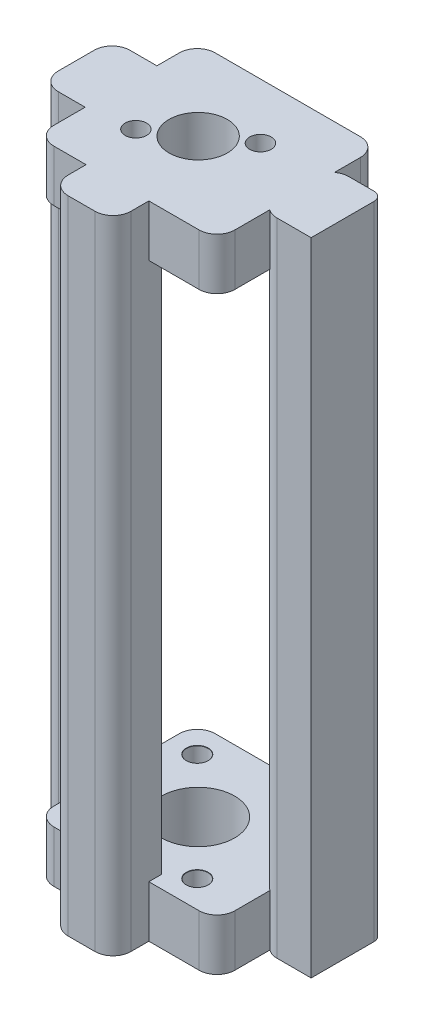
from build123d import *

# Parameters (mm, degrees)
SKETCH1_W                      = 20.2
SKETCH1_H                      = 18
BOSS_EXTRUDE1_DEPTH            = 5.75
M2_CLEARANCE_HOLE1_D           = 2.4
M2_CLEARANCE_HOLE1_CSINK_D     = 2.45
M2_CLEARANCE_HOLE1_CSINK_ANGLE = 90
SKETCH5_W                      = 5.8
SKETCH5_H                      = 8
BOSS_EXTRUDE2_DEPTH            = 60
SKETCH6_R                      = 4.0625
CUT_EXTRUDE1_DEPTH             = 5.75
SKETCH7_R                      = 3.25
CUT_EXTRUDE2_DEPTH             = 5.75
FILLET1_R                      = 2
M2_CLEARANCE_HOLE2_D           = 2.4
M2_CLEARANCE_HOLE2_DEPTH       = 5.75
M2_CLEARANCE_HOLE2_TIP         = 0.721032743
SKETCH11_W                     = 5
SKETCH11_H                     = 8
SKETCH11_W_2                   = 7
SKETCH11_H_2                   = 4
BOSS_EXTRUDE3_DEPTH            = 5.75
SKETCH12_W                     = 5
SKETCH12_H                     = 8
SKETCH12_W_2                   = 7
SKETCH12_H_2                   = 4
BOSS_EXTRUDE4_DEPTH            = 5.75
FILLET2_R                      = 2
SKETCH14_W                     = 24.4
SKETCH14_H                     = 1
CUT_EXTRUDE3_DEPTH             = 2
FILLET3_R                      = 1
FILLET4_R                      = 1


with BuildPart() as part:
    # Sketch1 → Boss-Extrude1 (new body)
    with BuildSketch(Plane(origin=(0, 0, 0), x_dir=(1, 0, 0), z_dir=(0, 1, 0))):
        with Locations((1, 0)):
            Rectangle(SKETCH1_W, SKETCH1_H)
    boss_extrude1 = extrude(amount=BOSS_EXTRUDE1_DEPTH)

    # M2 Clearance Hole1 (through all)
    with Locations(Plane(origin=(0, 5.75, 0), x_dir=(1, 0, 0), z_dir=(0, 1, 0))):
        with Locations((-6.1, 6), (5.9, 6), (-6.1, -6), (5.9, -6)):
            CounterSinkHole(M2_CLEARANCE_HOLE1_D / 2, M2_CLEARANCE_HOLE1_CSINK_D / 2, counter_sink_angle=M2_CLEARANCE_HOLE1_CSINK_ANGLE)

    # Sketch5 → Boss-Extrude2 (add)
    with BuildSketch(Plane(origin=(0, 5.75, 0), x_dir=(1, 0, 0), z_dir=(0, 1, 0))):
        with Locations((-11.2, 0.5)):
            Rectangle(SKETCH5_W, SKETCH5_H)
        Polygon((3.5, -7.6), (-1.5, -7.6), (-3.5, -7.6), (-3.5, -9), (-3.5, -13), (3.5, -13), (3.5, -9), align=None)
        with Locations((13.2, 0.5)):
            Rectangle(SKETCH5_W, SKETCH5_H)
    extrude(amount=BOSS_EXTRUDE2_DEPTH)

    # Sketch6 → Cut-Extrude1 (cut)
    with BuildSketch(Plane(origin=(0, 5.75, 0), x_dir=(1, 0, 0), z_dir=(0, 1, 0))):
        with Locations(Location((0, 0, 0), (0, 0, 270))):
            Circle(SKETCH6_R)
    extrude(amount=-CUT_EXTRUDE1_DEPTH, mode=Mode.SUBTRACT)

    # Mirror1: Boss-Extrude1 across plane
    add(boss_extrude1.mirror(Plane.ZX.offset(35.75)))

    # Sketch7 → Cut-Extrude2 (cut)
    with BuildSketch(Plane(origin=(0, 71.5, 0), x_dir=(1, 0, 0), z_dir=(0, 1, 0))):
        with Locations(Location((0, 0, 0), (0, 0, 270))):
            Circle(SKETCH7_R)
    extrude(amount=-CUT_EXTRUDE2_DEPTH, mode=Mode.SUBTRACT)

    # Fillet1
    fillet1_edges = [part.edges().sort_by_distance(p)[0] for p in [
        (11.1, 68.625, -9),
        (11.1, 68.625, 9),
        (-9.1, 68.625, 9),
        (-9.1, 68.625, -9),
        (11.1, 2.875, 9),
        (-9.1, 2.875, 9),
        (-9.1, 2.875, -9),
        (11.1, 2.875, -9),
    ]]
    fillet(fillet1_edges, radius=FILLET1_R)

    # M2 Clearance Hole2
    with Locations(Plane(origin=(0, 71.5, 0), x_dir=(1, 0, 0), z_dir=(0, 1, 0))):
        with Locations((-4.142372511, -2.800133921), (4.142372511, 2.800133921)):
            Hole(M2_CLEARANCE_HOLE2_D / 2, depth=M2_CLEARANCE_HOLE2_DEPTH)
            with Locations((0, 0, -(M2_CLEARANCE_HOLE2_DEPTH + M2_CLEARANCE_HOLE2_TIP / 2))):  # 118° drill point
                Cone(0, M2_CLEARANCE_HOLE2_D / 2, M2_CLEARANCE_HOLE2_TIP, mode=Mode.SUBTRACT)

    # Sketch11 → Boss-Extrude3 (add)
    with BuildSketch(Plane(origin=(0, 65.75, 0), x_dir=(1, 0, 0), z_dir=(0, 1, 0))):
        with Locations((-11.6, 0.5)):
            Rectangle(SKETCH11_W, SKETCH11_H)
        with Locations((13.6, 0.5)):
            Rectangle(SKETCH11_W, SKETCH11_H)
        with Locations((0, -11)):
            Rectangle(SKETCH11_W_2, SKETCH11_H_2)
    extrude(amount=BOSS_EXTRUDE3_DEPTH)

    # Sketch12 → Boss-Extrude4 (add)
    with BuildSketch(Plane.XZ.offset(-5.75)):
        with Locations((-11.6, -0.5)):
            Rectangle(SKETCH12_W, SKETCH12_H)
        with Locations((0, 11)):
            Rectangle(SKETCH12_W_2, SKETCH12_H_2)
        with Locations((13.6, -0.5)):
            Rectangle(SKETCH12_W, SKETCH12_H)
    extrude(amount=BOSS_EXTRUDE4_DEPTH)

    # Fillet2
    fillet2_edges = [part.edges().sort_by_distance(p)[0] for p in [
        (-14.1, 35.75, -4.5),
        (-14.1, 35.75, 3.5),
        (3.5, 35.75, 13),
        (-3.5, 35.75, 13),
        (10.3, 35.75, 3.5),
        (10.3, 35.75, -4.5),
    ]]
    fillet(fillet2_edges, radius=FILLET2_R)

    # Sketch14 → Cut-Extrude3 (cut)
    with BuildSketch(Plane(origin=(0, 0, -4.5), x_dir=(-1, 0, 0), z_dir=(0, 0, -1))):
        with Locations((-0.1, 10.5)):
            Rectangle(SKETCH14_W, SKETCH14_H)
    extrude(amount=-CUT_EXTRUDE3_DEPTH, mode=Mode.SUBTRACT)

    # Fillet3
    fillet3_edges = [part.edges().sort_by_distance(p)[0] for p in [
        (10.885786438, 10, -3.914213562),
        (10.885786438, 11, -3.914213562),
        (-10.2, 10, -4.5),
        (-10.2, 11, -4.5),
    ]]
    fillet(fillet3_edges, radius=FILLET3_R)

    # Fillet4
    fillet4_edges = [part.edges().sort_by_distance(p)[0] for p in [
        (-8.3, 11, -3),
        (-8.3, 11.292893219, -4.207106781),
        (-8.3, 10, -3),
        (-8.3, 9.707106781, -4.207106781),
        (16.1, 35.75, -4.5),
        (-8.3, 38.875, -4.5),
        (-8.3, 7.375, -4.5),
    ]]
    fillet(fillet4_edges, radius=FILLET4_R)


solid = part.part
